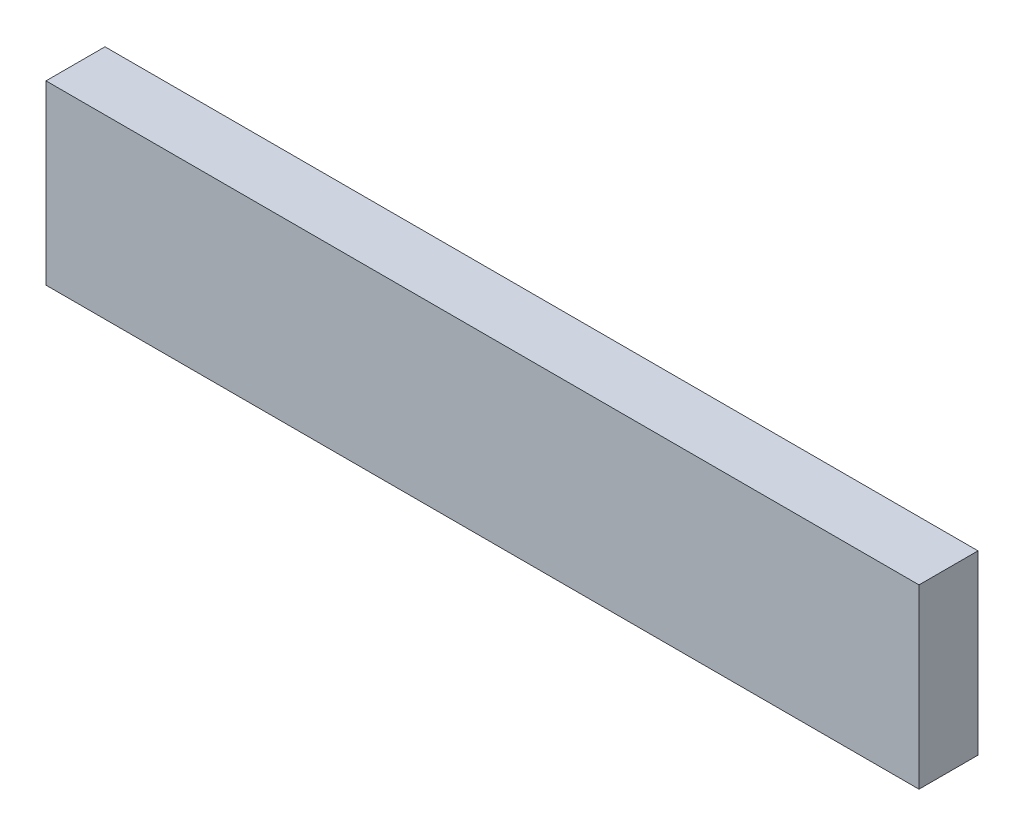
from build123d import *

# Parameters (mm, degrees)
SKETCH2_W           = 74
SKETCH2_H           = 15
BOSS_EXTRUDE2_DEPTH = 5


with BuildPart() as part:
    # Sketch2 → Boss-Extrude2 (new body)
    with BuildSketch(Plane.XY):
        Rectangle(SKETCH2_W, SKETCH2_H)
    extrude(amount=BOSS_EXTRUDE2_DEPTH)


solid = part.part
